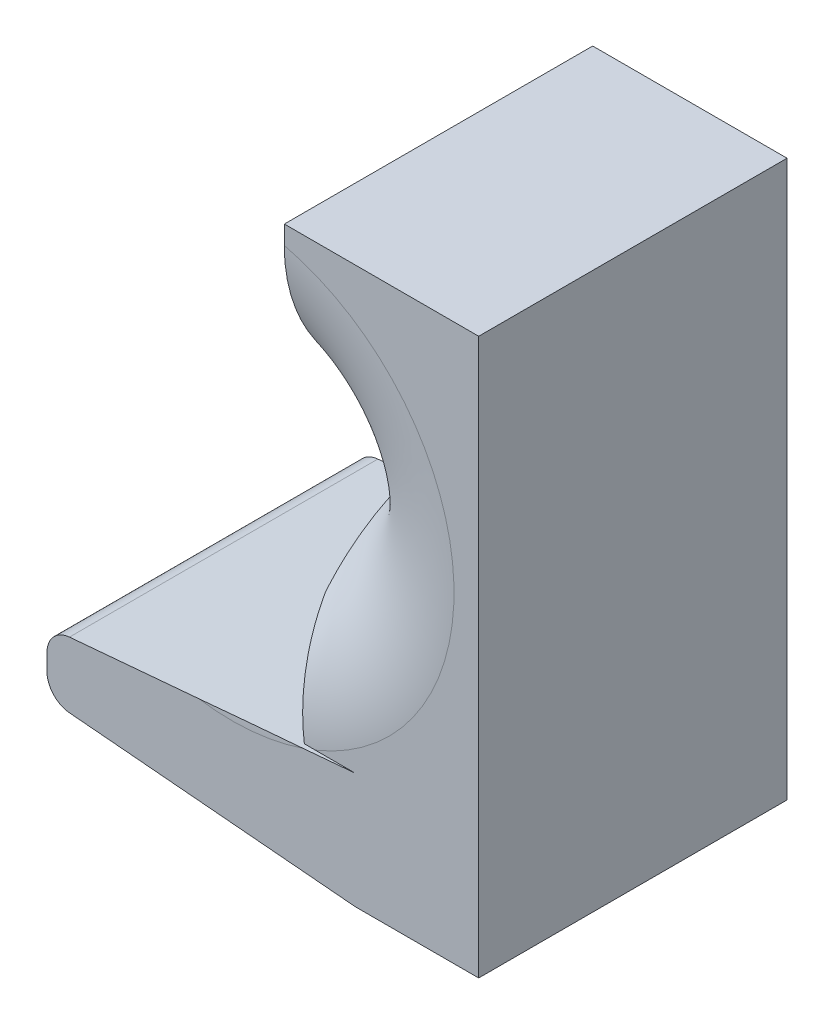
from build123d import *

# Parameters (mm, degrees)
BOSS_EXTRUDE1_DEPTH = 12.5
BOSS_EXTRUDE2_DEPTH = 5.757359
FILLET2_R           = 2


with BuildPart() as part:
    # Sketch2 → Boss-Extrude1 (new, symmetric)
    with BuildSketch(Plane.XY):
        Polygon((29.794654385, -25.049876185), (29.794654385, -48.549876185), (35.552013698, -48.549876185), (35.552013698, -60.735048324), (10.548146707, -62.92260323), (10.548146707, -67.92260323), (35.552013698, -70.110158136), (45.552013698, -70.110158136), (45.552013698, -25.049876185), align=None)
    extrude(amount=BOSS_EXTRUDE1_DEPTH, both=True)

    # Sketch4 → Boss-Extrude2 (add)
    with BuildSketch(Plane.ZY.offset(-35.552013698)):
        with BuildLine():
            Line((-12.5, -48.549876185), (-12.5, -60.735048324))
            Line((-12.5, -60.735048324), (-12.496034708, -60.735048324))
            ThreePointArc((-12.496034708, -60.735048324), (-8.726816448, -52.100425102), (8.7e-08, -48.549876185))
            Line((8.7e-08, -48.549876185), (-12.5, -48.549876185))
        make_face()
        with BuildLine():
            Line((12.5, -48.549876185), (8.7e-08, -48.549876185))
            ThreePointArc((8.7e-08, -48.549876185), (8.726816511, -52.100425163), (12.496034708, -60.735048324))
            Line((12.496034708, -60.735048324), (12.5, -60.735048324))
            Line((12.5, -60.735048324), (12.5, -48.549876185))
        make_face()
    extrude(amount=BOSS_EXTRUDE2_DEPTH)

    # Sketch3 → Cut-Revolve1 (revolve, cut)
    with BuildSketch(Plane.ZY.offset(-25.552013698)):
        with BuildLine():
            Line((-12.5, -44.049876185), (12.5, -44.049876185))
            Line((12.5, -44.049876185), (12.5, -26.049876185))
            ThreePointArc((12.5, -26.049876185), (0, -38.549876185), (-12.5, -26.049876185))
            Line((-12.5, -26.049876185), (-12.5, -44.049876185))
        make_face()
    revolve(axis=Axis((25.552013698, -44.049876185, -12.5), (0, 0, 1)), mode=Mode.SUBTRACT)

    # Fillet2
    fillet2_edges = [part.edges().sort_by_distance(p)[0] for p in [
        (10.548146707, -67.92260323, 0),
        (10.548146707, -62.92260323, 0),
    ]]
    fillet(fillet2_edges, radius=FILLET2_R)


solid = part.part
